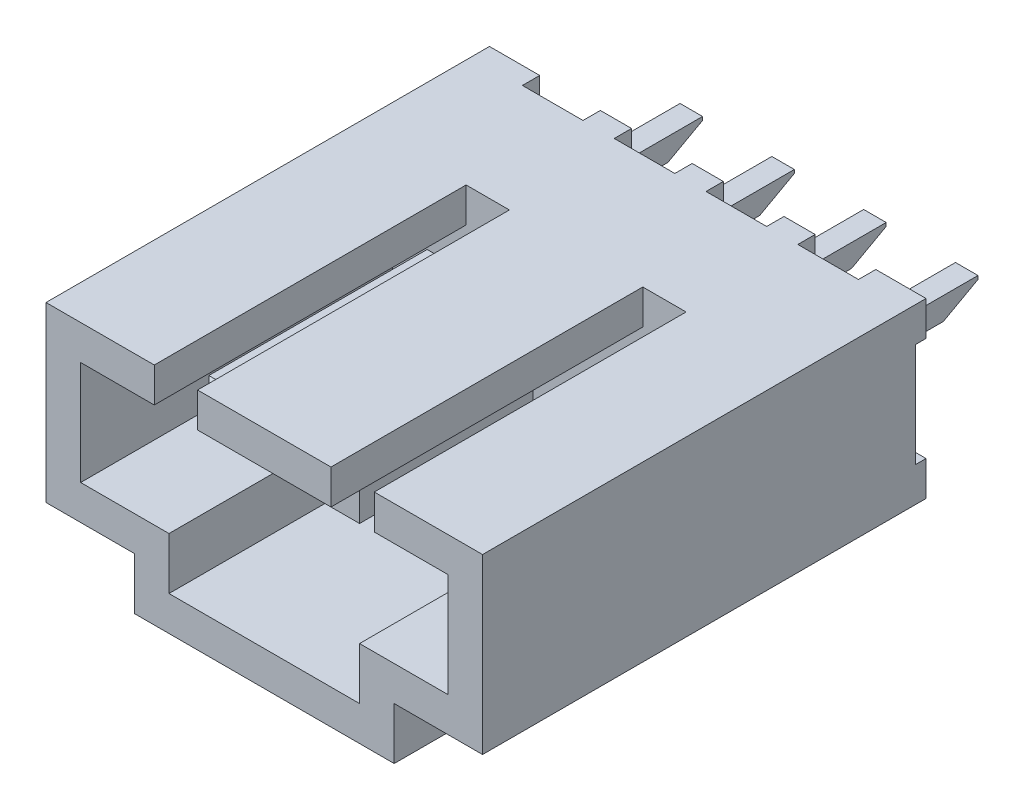
from build123d import *

# Parameters (mm, degrees)
BOSS_EXTRUDE1_DEPTH   = 12.8
CUT_EXTRUDE2_DEPTH    = 9
SKETCH5_W             = 1.5
SKETCH5_H             = 1
CUT_EXTRUDE3_DEPTH    = 4
SKETCH6_W             = 0.65
SKETCH6_H             = 0.65
BOSS_EXTRUDE3_DEPTH   = 13.8
BOSS_EXTRUDE3_2_DEPTH = 13.8
BOSS_EXTRUDE3_3_DEPTH = 13.8
BOSS_EXTRUDE3_4_DEPTH = 13.8
SKETCH7_W             = 1.75
SKETCH7_H             = 0.5
CUT_EXTRUDE5_DEPTH    = 16.677372229
SKETCH8_W             = 0.3
SKETCH8_H             = 3
CUT_EXTRUDE6_DEPTH    = 20.101047092
CUT_EXTRUDE7_DEPTH    = 18.845167413
CHAMFER1_SIZE         = 0.2
CHAMFER2_SIZE         = 0.2
CHAMFER3_SIZE         = 0.2
CHAMFER4_SIZE         = 0.2


with BuildPart() as part:
    # Sketch1 → Boss-Extrude1 (new body)
    with BuildSketch(Plane.XY):
        Polygon((0, 0), (6.3, 0), (6.3, -5), (3.75, -5), (3.75, -6.5), (0, -6.5), (-3.75, -6.5), (-3.75, -5), (-6.3, -5), (-6.3, 0), align=None)
    extrude(amount=BOSS_EXTRUDE1_DEPTH)

    # Sketch4 → Cut-Extrude2 (cut)
    with BuildSketch(Plane.XY.offset(12.8)):
        Polygon((-2.75, -4), (-1.25, -4), (-1.25, -5), (-2.75, -5), (-2.75, -5.5), (2.75, -5.5), (2.75, -5), (1.25, -5), (1.25, -4), (2.75, -4), (5.3, -4), (5.3, -1), (3.175, -1), (3.175, 0), (1.925, 0), (1.925, -1), (-1.925, -1), (-1.925, 0), (-3.175, 0), (-3.175, -1), (-5.3, -1), (-5.3, -4), align=None)
    extrude(amount=-CUT_EXTRUDE2_DEPTH, mode=Mode.SUBTRACT)

    # Sketch5 → Cut-Extrude3 (cut)
    with BuildSketch(Plane.XY.offset(12.8)):
        with Locations((-2, -4.5)):
            Rectangle(SKETCH5_W, SKETCH5_H)
        with Locations((2, -4.5)):
            Rectangle(SKETCH5_W, SKETCH5_H)
    extrude(amount=-CUT_EXTRUDE3_DEPTH, mode=Mode.SUBTRACT)

    # Sketch7 → Cut-Extrude5 (cut, through all)
    with BuildSketch(Plane(origin=(0, 0, 0), x_dir=(1, 0, 0), z_dir=(0, 1, 0))):
        with Locations((-3.975, -0.25)):
            Rectangle(SKETCH7_W, SKETCH7_H)
        with Locations((-1.325, -0.25)):
            Rectangle(SKETCH7_W, SKETCH7_H)
        with Locations((1.325, -0.25)):
            Rectangle(SKETCH7_W, SKETCH7_H)
        with Locations((3.975, -0.25)):
            Rectangle(SKETCH7_W, SKETCH7_H)
    extrude(amount=-CUT_EXTRUDE5_DEPTH, mode=Mode.SUBTRACT)

    # Sketch8 → Cut-Extrude6 (cut, through all)
    with BuildSketch(Plane.ZY.offset(6.3)):
        with Locations((0.15, -2.5)):
            Rectangle(SKETCH8_W, SKETCH8_H)
    extrude(amount=-CUT_EXTRUDE6_DEPTH, mode=Mode.SUBTRACT)


with BuildPart() as body_2:
    # Sketch6 → Boss-Extrude3 (new body)
    with BuildSketch(Plane.XY.offset(10.3)):
        with Locations((1.325, -2.5)):
            Rectangle(SKETCH6_W, SKETCH6_H)
    extrude(amount=-BOSS_EXTRUDE3_DEPTH)


with BuildPart() as body_3:
    # Sketch6 → Boss-Extrude3 2 (new body)
    with BuildSketch(Plane.XY.offset(10.3)):
        with Locations((3.975, -2.5)):
            Rectangle(SKETCH6_W, SKETCH6_H)
    extrude(amount=-BOSS_EXTRUDE3_2_DEPTH)


with BuildPart() as body_4:
    # Sketch6 → Boss-Extrude3 3 (new body)
    with BuildSketch(Plane.XY.offset(10.3)):
        with Locations((-3.975, -2.5)):
            Rectangle(SKETCH6_W, SKETCH6_H)
    extrude(amount=-BOSS_EXTRUDE3_3_DEPTH)


with BuildPart() as body_5:
    # Sketch6 → Boss-Extrude3 4 (new body)
    with BuildSketch(Plane.XY.offset(10.3)):
        with Locations((-1.325, -2.5)):
            Rectangle(SKETCH6_W, SKETCH6_H)
    extrude(amount=-BOSS_EXTRUDE3_4_DEPTH)


with BuildPart() as cut_extrude7_tool:
    # Sketch9 → Cut-Extrude7 (new, through all)
    with BuildSketch(Plane.ZY.offset(4.3)):
        Polygon((-3.5, -2.275), (-2.5, -2.825), (-3.5, -2.825), align=None)
    extrude(amount=-CUT_EXTRUDE7_DEPTH)


with BuildPart() as body_2_1:
    add(body_2.part)

    # Cut-Extrude7: cut by cut_extrude7_tool
    add(cut_extrude7_tool.part, mode=Mode.SUBTRACT)

    # Chamfer3
    chamfer3_edges = [body_2_1.edges().sort_by_distance(p)[0] for p in [
        (1.325, -2.175, 10.3),
        (1.65, -2.5, 10.3),
        (1.325, -2.825, 10.3),
        (1, -2.5, 10.3),
    ]]
    chamfer(chamfer3_edges, length=CHAMFER3_SIZE)


with BuildPart() as body_3_1:
    add(body_3.part)

    # Cut-Extrude7: cut by cut_extrude7_tool
    add(cut_extrude7_tool.part, mode=Mode.SUBTRACT)

    # Chamfer4
    chamfer4_edges = [body_3_1.edges().sort_by_distance(p)[0] for p in [
        (3.975, -2.175, 10.3),
        (4.3, -2.5, 10.3),
        (3.975, -2.825, 10.3),
        (3.65, -2.5, 10.3),
    ]]
    chamfer(chamfer4_edges, length=CHAMFER4_SIZE)


with BuildPart() as body_4_1:
    add(body_4.part)

    # Cut-Extrude7: cut by cut_extrude7_tool
    add(cut_extrude7_tool.part, mode=Mode.SUBTRACT)

    # Chamfer2
    chamfer2_edges = [body_4_1.edges().sort_by_distance(p)[0] for p in [
        (-3.975, -2.825, 10.3),
        (-4.3, -2.5, 10.3),
        (-3.975, -2.175, 10.3),
        (-3.65, -2.5, 10.3),
    ]]
    chamfer(chamfer2_edges, length=CHAMFER2_SIZE)


with BuildPart() as body_5_1:
    add(body_5.part)

    # Cut-Extrude7: cut by cut_extrude7_tool
    add(cut_extrude7_tool.part, mode=Mode.SUBTRACT)

    # Chamfer1
    chamfer1_edges = [body_5_1.edges().sort_by_distance(p)[0] for p in [
        (-1.325, -2.825, 10.3),
        (-1.65, -2.5, 10.3),
        (-1.325, -2.175, 10.3),
        (-1, -2.5, 10.3),
    ]]
    chamfer(chamfer1_edges, length=CHAMFER1_SIZE)


solid = Compound([part.part, body_2_1.part, body_3_1.part, body_4_1.part, body_5_1.part])
